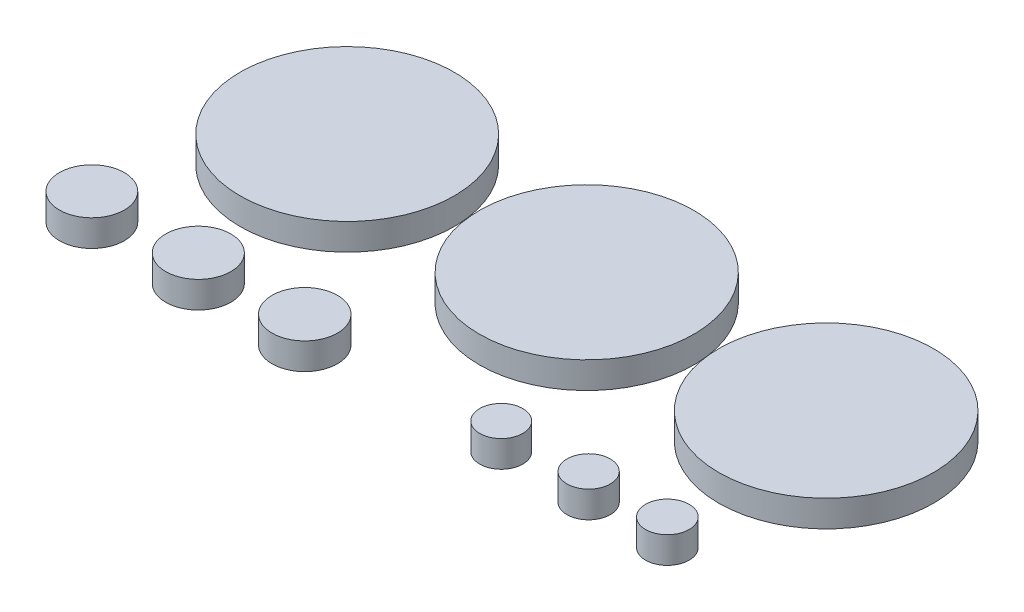
from build123d import *

# Parameters (mm, degrees)
SKETCH1_R             = 20.125
BOSS_EXTRUDE1_DEPTH   = 5
SKETCH1_R_2           = 20.15
BOSS_EXTRUDE1_2_DEPTH = 5
SKETCH1_R_3           = 20.175
BOSS_EXTRUDE1_3_DEPTH = 5
SKETCH1_R_4           = 6.1
BOSS_EXTRUDE1_4_DEPTH = 5
SKETCH1_R_5           = 6.125
BOSS_EXTRUDE1_5_DEPTH = 5
SKETCH1_R_6           = 6.15
BOSS_EXTRUDE1_6_DEPTH = 5
SKETCH1_R_7           = 4.05
BOSS_EXTRUDE1_7_DEPTH = 5
SKETCH1_R_8           = 4.075
BOSS_EXTRUDE1_8_DEPTH = 5
SKETCH1_R_9           = 4.1
BOSS_EXTRUDE1_9_DEPTH = 5


with BuildPart() as part:
    # Sketch1 → Boss-Extrude1 (new body)
    with BuildSketch(Plane(origin=(0, 0, 0), x_dir=(1, 0, 0), z_dir=(0, 1, 0))):
        with Locations(Location((-39.180734063, 31.166493004, 0), (0, 0, 270))):
            Circle(SKETCH1_R)
    extrude(amount=BOSS_EXTRUDE1_DEPTH)


with BuildPart() as body_2:
    # Sketch1 → Boss-Extrude1 2 (new body)
    with BuildSketch(Plane(origin=(0, 0, 0), x_dir=(1, 0, 0), z_dir=(0, 1, 0))):
        with Locations(Location((5.819265937, 31.166493004, 0), (0, 0, 270))):
            Circle(SKETCH1_R_2)
    extrude(amount=BOSS_EXTRUDE1_2_DEPTH)


with BuildPart() as body_3:
    # Sketch1 → Boss-Extrude1 3 (new body)
    with BuildSketch(Plane(origin=(0, 0, 0), x_dir=(1, 0, 0), z_dir=(0, 1, 0))):
        with Locations(Location((50.819265937, 31.166493004, 0), (0, 0, 270))):
            Circle(SKETCH1_R_3)
    extrude(amount=BOSS_EXTRUDE1_3_DEPTH)


with BuildPart() as body_4:
    # Sketch1 → Boss-Extrude1 4 (new body)
    with BuildSketch(Plane(origin=(0, 0, 0), x_dir=(1, 0, 0), z_dir=(0, 1, 0))):
        with Locations(Location((-53.84723252, -2.140724535, 0), (0, 0, 270))):
            Circle(SKETCH1_R_4)
    extrude(amount=BOSS_EXTRUDE1_4_DEPTH)


with BuildPart() as body_5:
    # Sketch1 → Boss-Extrude1 5 (new body)
    with BuildSketch(Plane(origin=(0, 0, 0), x_dir=(1, 0, 0), z_dir=(0, 1, 0))):
        with Locations(Location((-33.84723252, -2.140724535, 0), (0, 0, 270))):
            Circle(SKETCH1_R_5)
    extrude(amount=BOSS_EXTRUDE1_5_DEPTH)


with BuildPart() as body_6:
    # Sketch1 → Boss-Extrude1 6 (new body)
    with BuildSketch(Plane(origin=(0, 0, 0), x_dir=(1, 0, 0), z_dir=(0, 1, 0))):
        with Locations(Location((-13.84723252, -2.140724535, 0), (0, 0, 270))):
            Circle(SKETCH1_R_6)
    extrude(amount=BOSS_EXTRUDE1_6_DEPTH)


with BuildPart() as body_7:
    # Sketch1 → Boss-Extrude1 7 (new body)
    with BuildSketch(Plane(origin=(0, 0, 0), x_dir=(1, 0, 0), z_dir=(0, 1, 0))):
        with Locations(Location((21.98532932, -1.054889327, 0), (0, 0, 270))):
            Circle(SKETCH1_R_7)
    extrude(amount=BOSS_EXTRUDE1_7_DEPTH)


with BuildPart() as body_8:
    # Sketch1 → Boss-Extrude1 8 (new body)
    with BuildSketch(Plane(origin=(0, 0, 0), x_dir=(1, 0, 0), z_dir=(0, 1, 0))):
        with Locations(Location((38.40858683, -1.054889327, 0), (0, 0, 270))):
            Circle(SKETCH1_R_8)
    extrude(amount=BOSS_EXTRUDE1_8_DEPTH)


with BuildPart() as body_9:
    # Sketch1 → Boss-Extrude1 9 (new body)
    with BuildSketch(Plane(origin=(0, 0, 0), x_dir=(1, 0, 0), z_dir=(0, 1, 0))):
        with Locations(Location((53.203091529, -1.054889327, 0), (0, 0, 270))):
            Circle(SKETCH1_R_9)
    extrude(amount=BOSS_EXTRUDE1_9_DEPTH)


solid = Compound([part.part, body_2.part, body_3.part, body_4.part, body_5.part, body_6.part, body_7.part, body_8.part, body_9.part])
